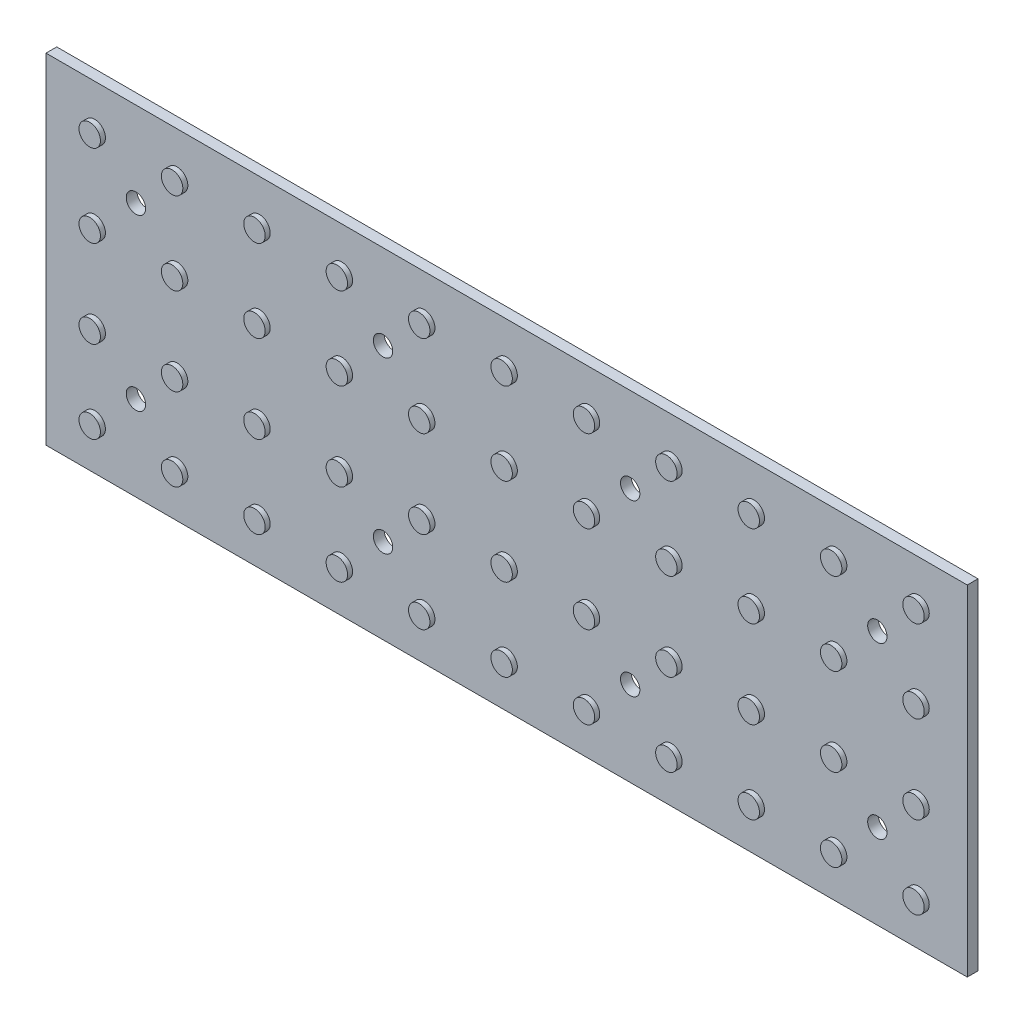
from build123d import *

# Parameters (mm, degrees)
SKETCH1_W                = 257.2
SKETCH1_H                = 94.8
BOSS_EXTRUDE1_DEPTH      = 3
SKETCH2_R                = 2.995
BOSS_EXTRUDE2_DEPTH      = 1.4
LPATTERN1_COUNT          = 2
LPATTERN1_PITCH          = 23
LPATTERN1_COUNT_DIR2     = 11
LPATTERN1_PITCH_DIR2     = 23
MIRROR4_COPY_1_SKETCH_R  = 2.995
MIRROR4_COPY_1_DEPTH     = 1.4
MIRROR4_COPY_2_SKETCH_R  = 2.995
MIRROR4_COPY_2_DEPTH     = 1.4
MIRROR4_COPY_3_SKETCH_R  = 2.995
MIRROR4_COPY_3_DEPTH     = 1.4
MIRROR4_COPY_4_SKETCH_R  = 2.995
MIRROR4_COPY_4_DEPTH     = 1.4
MIRROR4_COPY_5_SKETCH_R  = 2.995
MIRROR4_COPY_5_DEPTH     = 1.4
MIRROR4_COPY_6_SKETCH_R  = 2.995
MIRROR4_COPY_6_DEPTH     = 1.4
MIRROR4_COPY_7_SKETCH_R  = 2.995
MIRROR4_COPY_7_DEPTH     = 1.4
MIRROR4_COPY_8_SKETCH_R  = 2.995
MIRROR4_COPY_8_DEPTH     = 1.4
MIRROR4_COPY_9_SKETCH_R  = 2.995
MIRROR4_COPY_9_DEPTH     = 1.4
MIRROR4_COPY_10_SKETCH_R = 2.995
MIRROR4_COPY_10_DEPTH    = 1.4
MIRROR4_COPY_11_SKETCH_R = 2.995
MIRROR4_COPY_11_DEPTH    = 1.4
MIRROR4_COPY_12_SKETCH_R = 2.995
MIRROR4_COPY_12_DEPTH    = 1.4
MIRROR4_COPY_13_SKETCH_R = 2.995
MIRROR4_COPY_13_DEPTH    = 1.4
MIRROR4_COPY_14_SKETCH_R = 2.995
MIRROR4_COPY_14_DEPTH    = 1.4
MIRROR4_COPY_15_SKETCH_R = 2.995
MIRROR4_COPY_15_DEPTH    = 1.4
MIRROR4_COPY_16_SKETCH_R = 2.995
MIRROR4_COPY_16_DEPTH    = 1.4
MIRROR4_COPY_17_SKETCH_R = 2.995
MIRROR4_COPY_17_DEPTH    = 1.4
MIRROR4_COPY_18_SKETCH_R = 2.995
MIRROR4_COPY_18_DEPTH    = 1.4
MIRROR4_COPY_19_SKETCH_R = 2.995
MIRROR4_COPY_19_DEPTH    = 1.4
MIRROR4_COPY_20_SKETCH_R = 2.995
MIRROR4_COPY_20_DEPTH    = 1.4
MIRROR4_COPY_21_SKETCH_R = 2.995
MIRROR4_COPY_21_DEPTH    = 1.4
SKETCH3_R                = 2.7
CUT_EXTRUDE1_DEPTH       = 275.131136502


with BuildPart() as part:
    # Sketch1 → Boss-Extrude1 (new body)
    with BuildSketch(Plane.XY):
        with Locations((128.6, 47.4)):
            Rectangle(SKETCH1_W, SKETCH1_H)
    extrude(amount=BOSS_EXTRUDE1_DEPTH)

    # Sketch2 → Boss-Extrude2 (add)
    with BuildSketch(Plane.XY.offset(3)):
        with Locations((13.6, 12.2)):
            Circle(SKETCH2_R)
    boss_extrude2 = extrude(amount=BOSS_EXTRUDE2_DEPTH)

    # LPattern1: Boss-Extrude2 2 × 11
    with Locations(*[(j * LPATTERN1_PITCH_DIR2, i * LPATTERN1_PITCH, 0) for i in range(LPATTERN1_COUNT) for j in range(LPATTERN1_COUNT_DIR2) if (i, j) != (0, 0)]):
        add(boss_extrude2)

    # Mirror4: Boss-Extrude2 across plane
    add(boss_extrude2.mirror(Plane(origin=(0, 47.4, 0), x_dir=(0, 0, 1), z_dir=(0, -1, 0))))

    # Mirror4 copy 1 sketch → Mirror4 copy 1 (add)
    with BuildSketch(Plane(origin=(23, 94.8, 3), x_dir=(1, 0, 0), z_dir=(0, 0, 1))):
        with Locations((13.6, -12.2)):
            Circle(MIRROR4_COPY_1_SKETCH_R)
    extrude(amount=MIRROR4_COPY_1_DEPTH)

    # Mirror4 copy 2 sketch → Mirror4 copy 2 (add)
    with BuildSketch(Plane(origin=(46, 94.8, 3), x_dir=(1, 0, 0), z_dir=(0, 0, 1))):
        with Locations((13.6, -12.2)):
            Circle(MIRROR4_COPY_2_SKETCH_R)
    extrude(amount=MIRROR4_COPY_2_DEPTH)

    # Mirror4 copy 3 sketch → Mirror4 copy 3 (add)
    with BuildSketch(Plane(origin=(69, 94.8, 3), x_dir=(1, 0, 0), z_dir=(0, 0, 1))):
        with Locations((13.6, -12.2)):
            Circle(MIRROR4_COPY_3_SKETCH_R)
    extrude(amount=MIRROR4_COPY_3_DEPTH)

    # Mirror4 copy 4 sketch → Mirror4 copy 4 (add)
    with BuildSketch(Plane(origin=(92, 94.8, 3), x_dir=(1, 0, 0), z_dir=(0, 0, 1))):
        with Locations((13.6, -12.2)):
            Circle(MIRROR4_COPY_4_SKETCH_R)
    extrude(amount=MIRROR4_COPY_4_DEPTH)

    # Mirror4 copy 5 sketch → Mirror4 copy 5 (add)
    with BuildSketch(Plane(origin=(115, 94.8, 3), x_dir=(1, 0, 0), z_dir=(0, 0, 1))):
        with Locations((13.6, -12.2)):
            Circle(MIRROR4_COPY_5_SKETCH_R)
    extrude(amount=MIRROR4_COPY_5_DEPTH)

    # Mirror4 copy 6 sketch → Mirror4 copy 6 (add)
    with BuildSketch(Plane(origin=(138, 94.8, 3), x_dir=(1, 0, 0), z_dir=(0, 0, 1))):
        with Locations((13.6, -12.2)):
            Circle(MIRROR4_COPY_6_SKETCH_R)
    extrude(amount=MIRROR4_COPY_6_DEPTH)

    # Mirror4 copy 7 sketch → Mirror4 copy 7 (add)
    with BuildSketch(Plane(origin=(161, 94.8, 3), x_dir=(1, 0, 0), z_dir=(0, 0, 1))):
        with Locations((13.6, -12.2)):
            Circle(MIRROR4_COPY_7_SKETCH_R)
    extrude(amount=MIRROR4_COPY_7_DEPTH)

    # Mirror4 copy 8 sketch → Mirror4 copy 8 (add)
    with BuildSketch(Plane(origin=(184, 94.8, 3), x_dir=(1, 0, 0), z_dir=(0, 0, 1))):
        with Locations((13.6, -12.2)):
            Circle(MIRROR4_COPY_8_SKETCH_R)
    extrude(amount=MIRROR4_COPY_8_DEPTH)

    # Mirror4 copy 9 sketch → Mirror4 copy 9 (add)
    with BuildSketch(Plane(origin=(207, 94.8, 3), x_dir=(1, 0, 0), z_dir=(0, 0, 1))):
        with Locations((13.6, -12.2)):
            Circle(MIRROR4_COPY_9_SKETCH_R)
    extrude(amount=MIRROR4_COPY_9_DEPTH)

    # Mirror4 copy 10 sketch → Mirror4 copy 10 (add)
    with BuildSketch(Plane(origin=(230, 94.8, 3), x_dir=(1, 0, 0), z_dir=(0, 0, 1))):
        with Locations((13.6, -12.2)):
            Circle(MIRROR4_COPY_10_SKETCH_R)
    extrude(amount=MIRROR4_COPY_10_DEPTH)

    # Mirror4 copy 11 sketch → Mirror4 copy 11 (add)
    with BuildSketch(Plane(origin=(0, 71.8, 3), x_dir=(1, 0, 0), z_dir=(0, 0, 1))):
        with Locations((13.6, -12.2)):
            Circle(MIRROR4_COPY_11_SKETCH_R)
    extrude(amount=MIRROR4_COPY_11_DEPTH)

    # Mirror4 copy 12 sketch → Mirror4 copy 12 (add)
    with BuildSketch(Plane(origin=(23, 71.8, 3), x_dir=(1, 0, 0), z_dir=(0, 0, 1))):
        with Locations((13.6, -12.2)):
            Circle(MIRROR4_COPY_12_SKETCH_R)
    extrude(amount=MIRROR4_COPY_12_DEPTH)

    # Mirror4 copy 13 sketch → Mirror4 copy 13 (add)
    with BuildSketch(Plane(origin=(46, 71.8, 3), x_dir=(1, 0, 0), z_dir=(0, 0, 1))):
        with Locations((13.6, -12.2)):
            Circle(MIRROR4_COPY_13_SKETCH_R)
    extrude(amount=MIRROR4_COPY_13_DEPTH)

    # Mirror4 copy 14 sketch → Mirror4 copy 14 (add)
    with BuildSketch(Plane(origin=(69, 71.8, 3), x_dir=(1, 0, 0), z_dir=(0, 0, 1))):
        with Locations((13.6, -12.2)):
            Circle(MIRROR4_COPY_14_SKETCH_R)
    extrude(amount=MIRROR4_COPY_14_DEPTH)

    # Mirror4 copy 15 sketch → Mirror4 copy 15 (add)
    with BuildSketch(Plane(origin=(92, 71.8, 3), x_dir=(1, 0, 0), z_dir=(0, 0, 1))):
        with Locations((13.6, -12.2)):
            Circle(MIRROR4_COPY_15_SKETCH_R)
    extrude(amount=MIRROR4_COPY_15_DEPTH)

    # Mirror4 copy 16 sketch → Mirror4 copy 16 (add)
    with BuildSketch(Plane(origin=(115, 71.8, 3), x_dir=(1, 0, 0), z_dir=(0, 0, 1))):
        with Locations((13.6, -12.2)):
            Circle(MIRROR4_COPY_16_SKETCH_R)
    extrude(amount=MIRROR4_COPY_16_DEPTH)

    # Mirror4 copy 17 sketch → Mirror4 copy 17 (add)
    with BuildSketch(Plane(origin=(138, 71.8, 3), x_dir=(1, 0, 0), z_dir=(0, 0, 1))):
        with Locations((13.6, -12.2)):
            Circle(MIRROR4_COPY_17_SKETCH_R)
    extrude(amount=MIRROR4_COPY_17_DEPTH)

    # Mirror4 copy 18 sketch → Mirror4 copy 18 (add)
    with BuildSketch(Plane(origin=(161, 71.8, 3), x_dir=(1, 0, 0), z_dir=(0, 0, 1))):
        with Locations((13.6, -12.2)):
            Circle(MIRROR4_COPY_18_SKETCH_R)
    extrude(amount=MIRROR4_COPY_18_DEPTH)

    # Mirror4 copy 19 sketch → Mirror4 copy 19 (add)
    with BuildSketch(Plane(origin=(184, 71.8, 3), x_dir=(1, 0, 0), z_dir=(0, 0, 1))):
        with Locations((13.6, -12.2)):
            Circle(MIRROR4_COPY_19_SKETCH_R)
    extrude(amount=MIRROR4_COPY_19_DEPTH)

    # Mirror4 copy 20 sketch → Mirror4 copy 20 (add)
    with BuildSketch(Plane(origin=(207, 71.8, 3), x_dir=(1, 0, 0), z_dir=(0, 0, 1))):
        with Locations((13.6, -12.2)):
            Circle(MIRROR4_COPY_20_SKETCH_R)
    extrude(amount=MIRROR4_COPY_20_DEPTH)

    # Mirror4 copy 21 sketch → Mirror4 copy 21 (add)
    with BuildSketch(Plane(origin=(230, 71.8, 3), x_dir=(1, 0, 0), z_dir=(0, 0, 1))):
        with Locations((13.6, -12.2)):
            Circle(MIRROR4_COPY_21_SKETCH_R)
    extrude(amount=MIRROR4_COPY_21_DEPTH)

    # Sketch3 → Cut-Extrude1 (cut, through all)
    with BuildSketch(Plane.XY.offset(3)):
        with Locations((25.1, 71.1)):
            Circle(SKETCH3_R)
        with Locations((94.1, 71.1)):
            Circle(SKETCH3_R)
        with Locations((163.1, 71.1)):
            Circle(SKETCH3_R)
        with Locations((232.1, 71.1)):
            Circle(SKETCH3_R)
    cut_extrude1 = extrude(amount=-CUT_EXTRUDE1_DEPTH, mode=Mode.SUBTRACT)

    # Mirror3: Cut-Extrude1 across plane
    add(cut_extrude1.mirror(Plane(origin=(0, 47.4, 0), x_dir=(0, 0, 1), z_dir=(0, -1, 0))), mode=Mode.SUBTRACT)


solid = part.part
